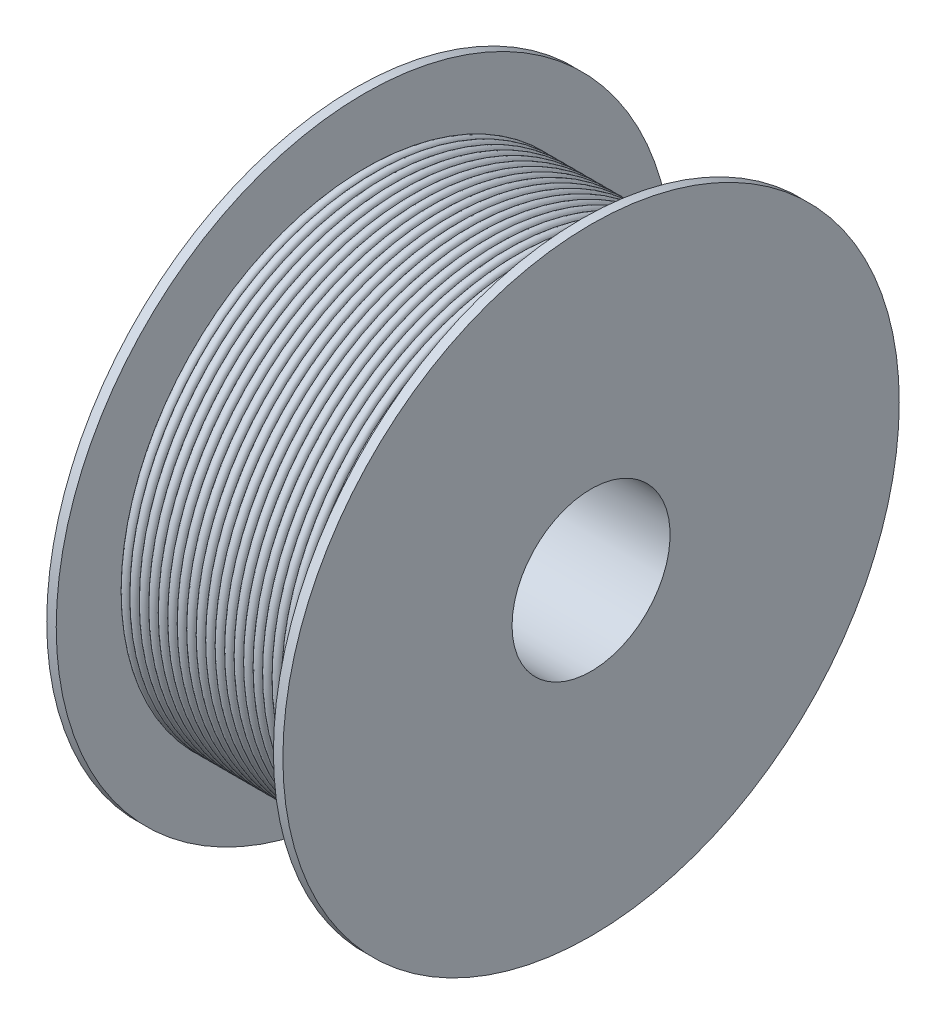
from build123d import *


with BuildPart() as part:
    # Sketch1 → Revolve1 (revolve)
    with BuildSketch(Plane(origin=(0, 0, 0), x_dir=(1, 0, 0), z_dir=(0, 1, 0)), mode=Mode.PRIVATE) as revolve1_sk:
        with BuildLine():
            Line((0, 58.783038795), (0, 131.283038795))
            Line((0, 131.283038795), (3, 131.283038795))
            Line((3, 131.283038795), (3, 110.189064257))
            ThreePointArc((3, 110.189064257), (4.372298868, 111.561363125), (5.744597737, 110.189064257))
            ThreePointArc((5.744597737, 110.189064257), (7.116896605, 111.561363125), (8.489195473, 110.189064257))
            Line((8.489195473, 110.189064257), (8.744597737, 110.189064257))
            ThreePointArc((8.744597737, 110.189064257), (10.116896605, 111.561363125), (11.489195473, 110.189064257))
            Line((11.489195473, 110.189064257), (11.744597737, 110.189064257))
            ThreePointArc((11.744597737, 110.189064257), (13.116896605, 111.561363125), (14.489195473, 110.189064257))
            Line((14.489195473, 110.189064257), (14.744597737, 110.189064257))
            ThreePointArc((14.744597737, 110.189064257), (16.116896605, 111.561363125), (17.489195473, 110.189064257))
            Line((17.489195473, 110.189064257), (17.744597737, 110.189064257))
            ThreePointArc((17.744597737, 110.189064257), (19.116896605, 111.561363125), (20.489195473, 110.189064257))
            Line((20.489195473, 110.189064257), (20.744597737, 110.189064257))
            ThreePointArc((20.744597737, 110.189064257), (22.116896605, 111.561363125), (23.489195473, 110.189064257))
            Line((23.489195473, 110.189064257), (23.744597737, 110.189064257))
            ThreePointArc((23.744597737, 110.189064257), (25.116896605, 111.561363125), (26.489195473, 110.189064257))
            Line((26.489195473, 110.189064257), (26.744597737, 110.189064257))
            ThreePointArc((26.744597737, 110.189064257), (28.116896605, 111.561363125), (29.489195473, 110.189064257))
            Line((29.489195473, 110.189064257), (29.744597737, 110.189064257))
            ThreePointArc((29.744597737, 110.189064257), (31.116896605, 111.561363125), (32.489195473, 110.189064257))
            Line((32.489195473, 110.189064257), (32.744597737, 110.189064257))
            ThreePointArc((32.744597737, 110.189064257), (34.116896605, 111.561363125), (35.489195473, 110.189064257))
            Line((35.489195473, 110.189064257), (35.744597737, 110.189064257))
            ThreePointArc((35.744597737, 110.189064257), (37.116896605, 111.561363125), (38.489195473, 110.189064257))
            Line((38.489195473, 110.189064257), (38.744597737, 110.189064257))
            ThreePointArc((38.744597737, 110.189064257), (40.116896605, 111.561363125), (41.489195473, 110.189064257))
            Line((41.489195473, 110.189064257), (41.744597737, 110.189064257))
            ThreePointArc((41.744597737, 110.189064257), (43.116896605, 111.561363125), (44.489195473, 110.189064257))
            Line((44.489195473, 110.189064257), (44.744597737, 110.189064257))
            ThreePointArc((44.744597737, 110.189064257), (46.116896605, 111.561363125), (47.489195473, 110.189064257))
            Line((47.489195473, 110.189064257), (47.744597737, 110.189064257))
            ThreePointArc((47.744597737, 110.189064257), (49.116896605, 111.561363125), (50.489195473, 110.189064257))
            Line((50.489195473, 110.189064257), (50.744597737, 110.189064257))
            ThreePointArc((50.744597737, 110.189064257), (52.116896605, 111.561363125), (53.489195473, 110.189064257))
            Line((53.489195473, 110.189064257), (53.744597737, 110.189064257))
            ThreePointArc((53.744597737, 110.189064257), (55.116896605, 111.561363125), (56.489195473, 110.189064257))
            Line((56.489195473, 110.189064257), (56.744597737, 110.189064257))
            ThreePointArc((56.744597737, 110.189064257), (58.116896605, 111.561363125), (59.489195473, 110.189064257))
            Line((59.489195473, 110.189064257), (59.744597737, 110.189064257))
            ThreePointArc((59.744597737, 110.189064257), (61.116896605, 111.561363125), (62.489195473, 110.189064257))
            Line((62.489195473, 110.189064257), (62.744597737, 110.189064257))
            ThreePointArc((62.744597737, 110.189064257), (64.116896605, 111.561363125), (65.489195473, 110.189064257))
            Line((65.489195473, 110.189064257), (65.744597737, 110.189064257))
            ThreePointArc((65.744597737, 110.189064257), (67.116896605, 111.561363125), (68.489195473, 110.189064257))
            Line((68.489195473, 110.189064257), (68.744597737, 110.189064257))
            ThreePointArc((68.744597737, 110.189064257), (70.116896605, 111.561363125), (71.489195473, 110.189064257))
            Line((71.489195473, 110.189064257), (71.707548459, 110.189064257))
            Line((71.707548459, 110.189064257), (71.707548459, 131.283038795))
            Line((71.707548459, 131.283038795), (74.707548459, 131.283038795))
            Line((74.707548459, 131.283038795), (74.707548459, 58.783038795))
            Line((74.707548459, 58.783038795), (0, 58.783038795))
        make_face()
    revolve(revolve1_sk.sketch.rotate(Axis((-2.327356302, 0, -33.783038795), (1, 0, 0)), 180), axis=Axis((-2.327356302, 0, -33.783038795), (1, 0, 0)))


solid = part.part
